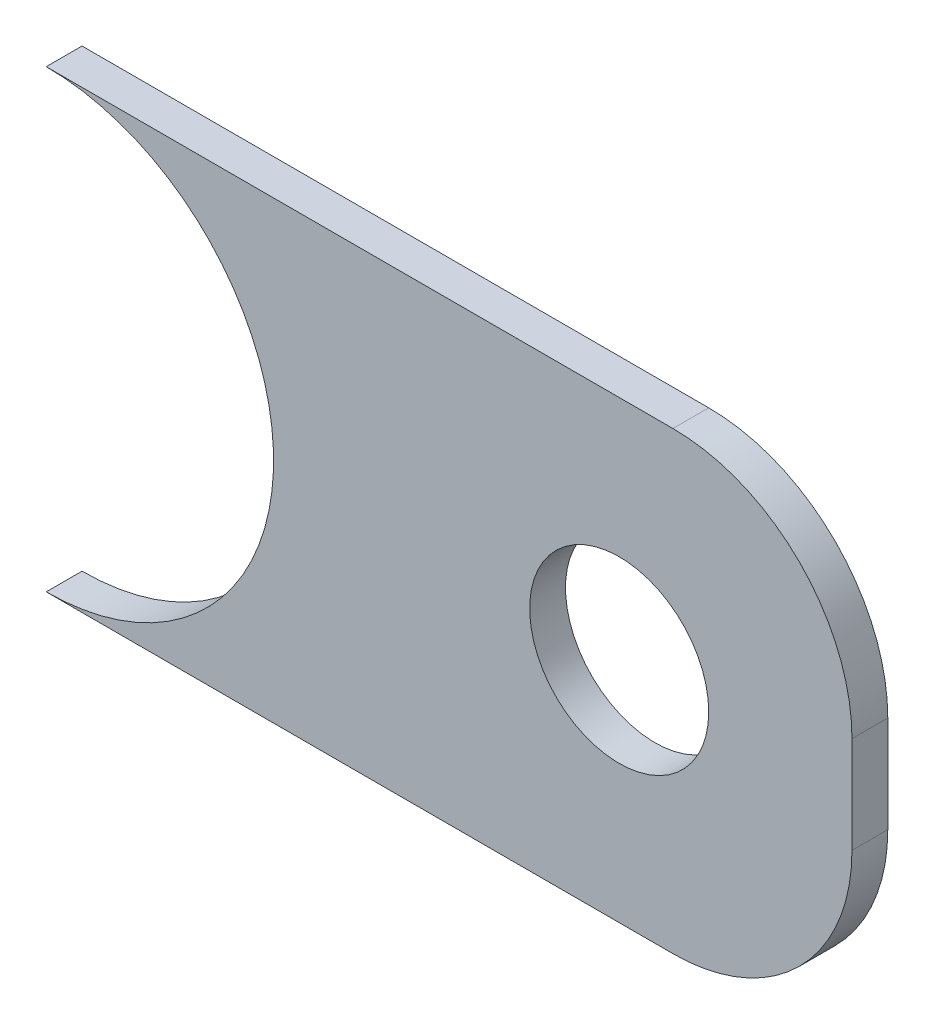
from build123d import *

# Parameters (mm, degrees)
SKETCH1_R           = 5
BOSS_EXTRUDE1_DEPTH = 2


with BuildPart() as part:
    # Sketch1 → Boss-Extrude1 (new body)
    with BuildSketch(Plane.XY):
        with BuildLine():
            Line((0, 12.7), (35, 12.7))
            ThreePointArc((35, 12.7), (42.071067812, 9.771067812), (45, 2.7))
            Line((45, 2.7), (45, -2.7))
            ThreePointArc((45, -2.7), (42.071067812, -9.771067812), (35, -12.7))
            Line((35, -12.7), (0, -12.7))
            ThreePointArc((0, -12.7), (12.7, 0), (0, 12.7))
        make_face()
        with Locations((32, 0)):
            Circle(SKETCH1_R, mode=Mode.SUBTRACT)
    extrude(amount=BOSS_EXTRUDE1_DEPTH)


solid = part.part
